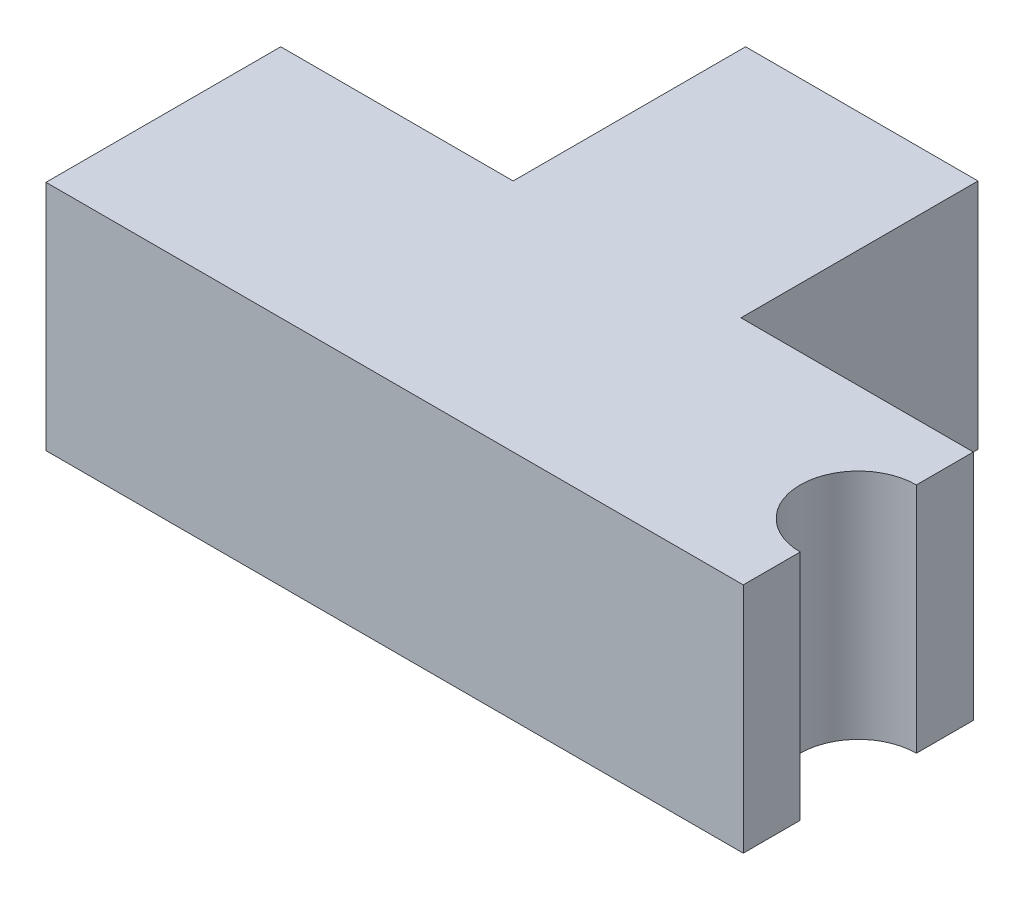
from build123d import *

# Parameters (mm, degrees)
BOSS_EXTRUDE1_DEPTH = 10
SKETCH2_R           = 2.5
CUT_EXTRUDE1_DEPTH  = 24.612445876


with BuildPart() as part:
    # Sketch1 → Boss-Extrude1 (new body)
    with BuildSketch(Plane(origin=(0, 0, 0), x_dir=(1, 0, 0), z_dir=(0, 1, 0))):
        Polygon((4.85, 4.9005), (14.85, 4.9005), (14.85, -4.9995), (-15.15, -4.9995), (-15.15, 5.1005), (-5.15, 5.1005), (-5.15, 15.1005), (4.85, 15.1005), align=None)
    extrude(amount=BOSS_EXTRUDE1_DEPTH)

    # Sketch2 → Cut-Extrude1 (cut, through all)
    with BuildSketch(Plane(origin=(0, 10, 0), x_dir=(1, 0, 0), z_dir=(0, 1, 0))):
        with Locations((14.85, -0.0495)):
            Circle(SKETCH2_R)
    extrude(amount=-CUT_EXTRUDE1_DEPTH, mode=Mode.SUBTRACT)


solid = part.part
